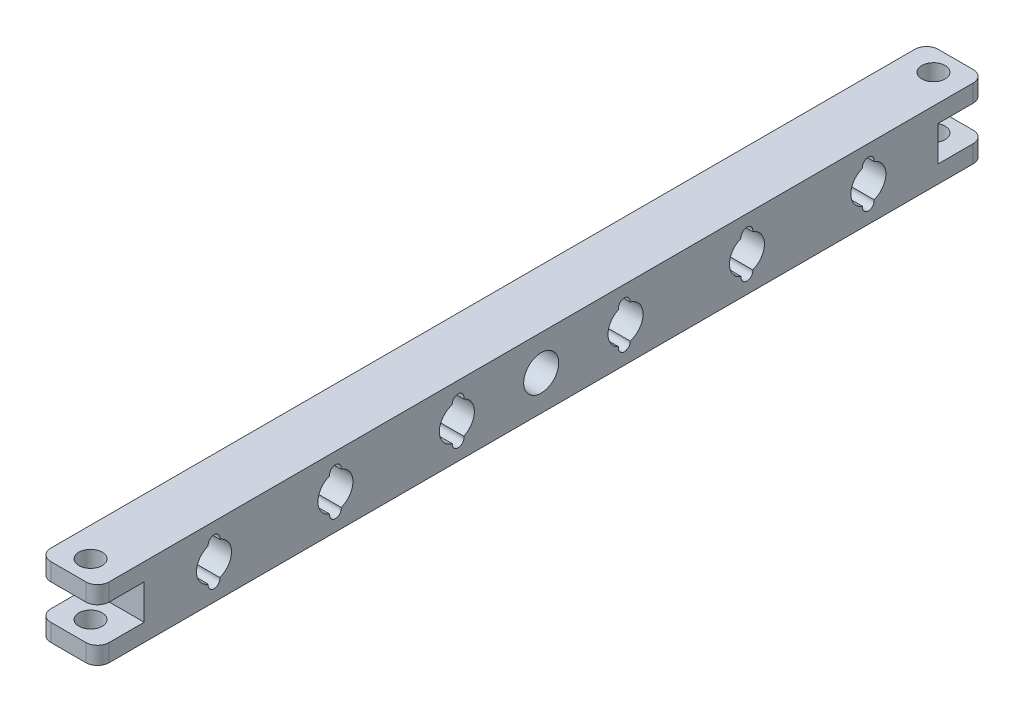
from build123d import *

# Parameters (mm, degrees)
SKETCH1_W           = 863.6
SKETCH1_H           = 76.2
BOSS_EXTRUDE1_DEPTH = 63.5
SKETCH2_R           = 19.05
CUT_EXTRUDE1_DEPTH  = 63.5
SKETCH3_W           = 63.5
SKETCH3_H           = 19.05
BOSS_EXTRUDE2_DEPTH = 50.8
SKETCH4_W           = 63.5
SKETCH4_H           = 19.05
BOSS_EXTRUDE3_DEPTH = 50.8
SKETCH5_R           = 12.7
CUT_EXTRUDE2_DEPTH  = 221.742
FILLET1_R           = 12.7


with BuildPart() as part:
    # Sketch1 → Boss-Extrude1 (new body)
    with BuildSketch(Plane(origin=(0, 0, 0), x_dir=(0, 0, -1), z_dir=(1, 0, 0))):
        Rectangle(SKETCH1_W, SKETCH1_H)
        with BuildLine():
            ThreePointArc((-362.147128046, 17.991666667), (-374.935943609, 0), (-362.147128046, -17.991666667))
            ThreePointArc((-362.147128046, -17.991666667), (-355.885943609, -25.4), (-349.624759172, -17.991666667))
            ThreePointArc((-349.624759172, -17.991666667), (-336.835943609, 0), (-349.624759172, 17.991666667))
            ThreePointArc((-349.624759172, 17.991666667), (-355.885943609, 25.4), (-362.147128046, 17.991666667))
        make_face(mode=Mode.SUBTRACT)
        with BuildLine():
            ThreePointArc((-230.067128046, 17.991666667), (-242.855943609, 0), (-230.067128046, -17.991666667))
            ThreePointArc((-230.067128046, -17.991666667), (-223.805943609, -25.4), (-217.544759172, -17.991666667))
            ThreePointArc((-217.544759172, -17.991666667), (-204.755943609, 0), (-217.544759172, 17.991666667))
            ThreePointArc((-217.544759172, 17.991666667), (-223.805943609, 25.4), (-230.067128046, 17.991666667))
        make_face(mode=Mode.SUBTRACT)
        with BuildLine():
            ThreePointArc((-96.728869239, 18.381328438), (-110.775943609, 0), (-96.728869239, -18.381328438))
            ThreePointArc((-96.728869239, -18.381328438), (-89.970708805, -25.339280787), (-84.23643534, -17.51598601))
            ThreePointArc((-84.23643534, -17.51598601), (-72.675943609, 0), (-84.23643534, 17.51598601))
            ThreePointArc((-84.23643534, 17.51598601), (-89.970708805, 25.339280787), (-96.728869239, 18.381328438))
        make_face(mode=Mode.SUBTRACT)
        with BuildLine():
            ThreePointArc((84.23643534, -17.51598601), (72.675943609, 0), (84.23643534, 17.51598601))
            ThreePointArc((84.23643534, 17.51598601), (89.970708805, 25.339280787), (96.728869239, 18.381328438))
            ThreePointArc((96.728869239, 18.381328438), (110.775943609, 0), (96.728869239, -18.381328438))
            ThreePointArc((96.728869239, -18.381328438), (89.970708805, -25.339280787), (84.23643534, -17.51598601))
        make_face(mode=Mode.SUBTRACT)
        with BuildLine():
            ThreePointArc((217.544759172, -17.991666667), (204.755943609, 0), (217.544759172, 17.991666667))
            ThreePointArc((217.544759172, 17.991666667), (223.805943609, 25.4), (230.067128046, 17.991666667))
            ThreePointArc((230.067128046, 17.991666667), (242.855943609, 0), (230.067128046, -17.991666667))
            ThreePointArc((230.067128046, -17.991666667), (223.805943609, -25.4), (217.544759172, -17.991666667))
        make_face(mode=Mode.SUBTRACT)
        with BuildLine():
            ThreePointArc((349.624759172, -17.991666667), (336.835943609, 0), (349.624759172, 17.991666667))
            ThreePointArc((349.624759172, 17.991666667), (355.885943609, 25.4), (362.147128046, 17.991666667))
            ThreePointArc((362.147128046, 17.991666667), (374.935943609, 0), (362.147128046, -17.991666667))
            ThreePointArc((362.147128046, -17.991666667), (355.885943609, -25.4), (349.624759172, -17.991666667))
        make_face(mode=Mode.SUBTRACT)
    extrude(amount=BOSS_EXTRUDE1_DEPTH)

    # Sketch2 → Cut-Extrude1 (cut)
    with BuildSketch(Plane(origin=(63.5, 0, 0), x_dir=(0, 0, -1), z_dir=(1, 0, 0))):
        Circle(SKETCH2_R)
    extrude(amount=-CUT_EXTRUDE1_DEPTH, mode=Mode.SUBTRACT)

    # Sketch3 → Boss-Extrude2 (add)
    with BuildSketch(Plane(origin=(0, 0, -431.8), x_dir=(-1, 0, 0), z_dir=(0, 0, -1))):
        with Locations((-31.75, 28.575)):
            Rectangle(SKETCH3_W, SKETCH3_H)
        with Locations((-31.75, -28.575)):
            Rectangle(SKETCH3_W, SKETCH3_H)
    extrude(amount=BOSS_EXTRUDE2_DEPTH)

    # Sketch4 → Boss-Extrude3 (add)
    with BuildSketch(Plane.XY.offset(431.8)):
        with Locations((31.75, -28.575)):
            Rectangle(SKETCH4_W, SKETCH4_H)
        with Locations((31.75, 28.575)):
            Rectangle(SKETCH4_W, SKETCH4_H)
    extrude(amount=BOSS_EXTRUDE3_DEPTH)

    # Sketch5 → Cut-Extrude2 (cut)
    with BuildSketch(Plane(origin=(0, 38.1, 0), x_dir=(1, 0, 0), z_dir=(0, 1, 0))):
        with Locations(Location((31.75, 458.42897264, 0), (0, 0, 270))):
            Circle(SKETCH5_R)
        with Locations(Location((31.75, -458.42897264, 0), (0, 0, 270))):
            Circle(SKETCH5_R)
    extrude(amount=-CUT_EXTRUDE2_DEPTH, mode=Mode.SUBTRACT)

    # Fillet1
    fillet1_edges = [part.edges().sort_by_distance(p)[0] for p in [
        (0, -28.575, -482.6),
        (63.5, -28.575, -482.6),
        (63.5, 28.575, -482.6),
        (0, 28.575, -482.6),
        (0, 28.575, 482.6),
        (63.5, 28.575, 482.6),
        (63.5, -28.575, 482.6),
        (0, -28.575, 482.6),
    ]]
    fillet(fillet1_edges, radius=FILLET1_R)


solid = part.part
